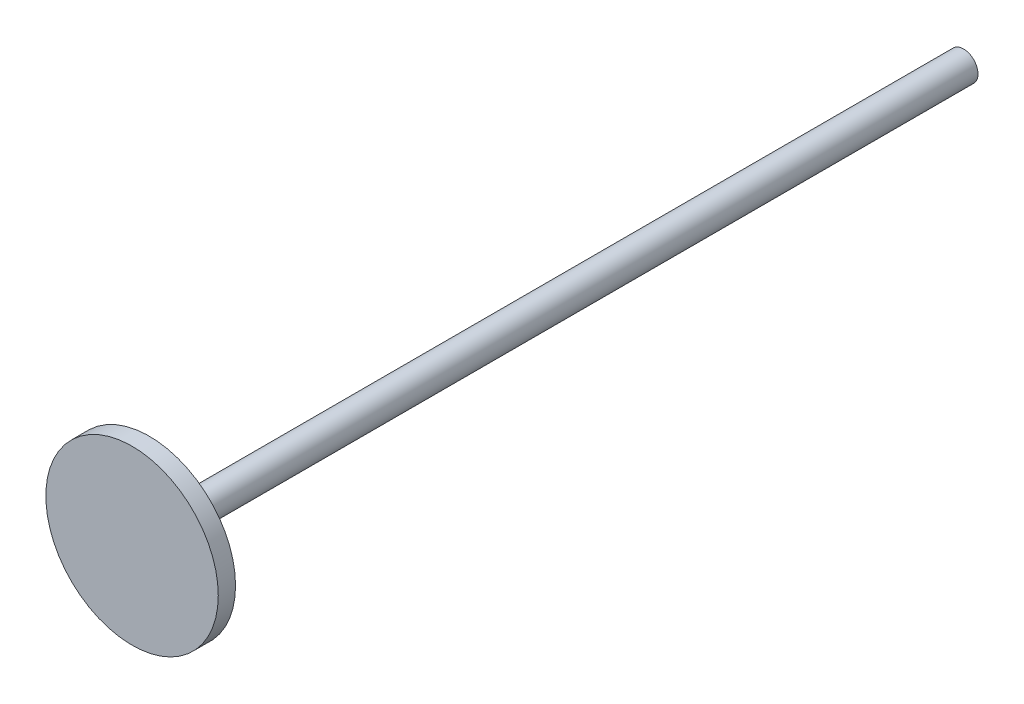
from build123d import *

# Parameters (mm, degrees)
SKETCH1_R           = 23.85
BOSS_EXTRUDE1_DEPTH = 230
SKETCH2_OUTSIDE_W   = 97.638
SKETCH2_OUTSIDE_H   = 97.638
SKETCH2_OUTSIDE_R   = 4
CUT_EXTRUDE1_DEPTH  = 218


with BuildPart() as part:
    # Sketch1 → Boss-Extrude1 (new body)
    with BuildSketch(Plane.XY):
        Circle(SKETCH1_R)
    extrude(amount=BOSS_EXTRUDE1_DEPTH)

    # Sketch2 outside → Cut-Extrude1 (cut)
    with BuildSketch(Plane.XY):
        Rectangle(SKETCH2_OUTSIDE_W, SKETCH2_OUTSIDE_H)
        Circle(SKETCH2_OUTSIDE_R, mode=Mode.SUBTRACT)
    extrude(amount=CUT_EXTRUDE1_DEPTH, mode=Mode.SUBTRACT)

    # Sketch5 → Cut-Revolve1 (revolve, cut)
    with BuildSketch(Plane(origin=(0, 0, 0), x_dir=(1, 0, 0), z_dir=(0, 1, 0))):
        Polygon((4, -218), (23.85, -225.22480915), (23.85, -218), align=None)
    revolve(axis=Axis((0, 0, 0), (0, 0, 1)), mode=Mode.SUBTRACT)


solid = part.part
